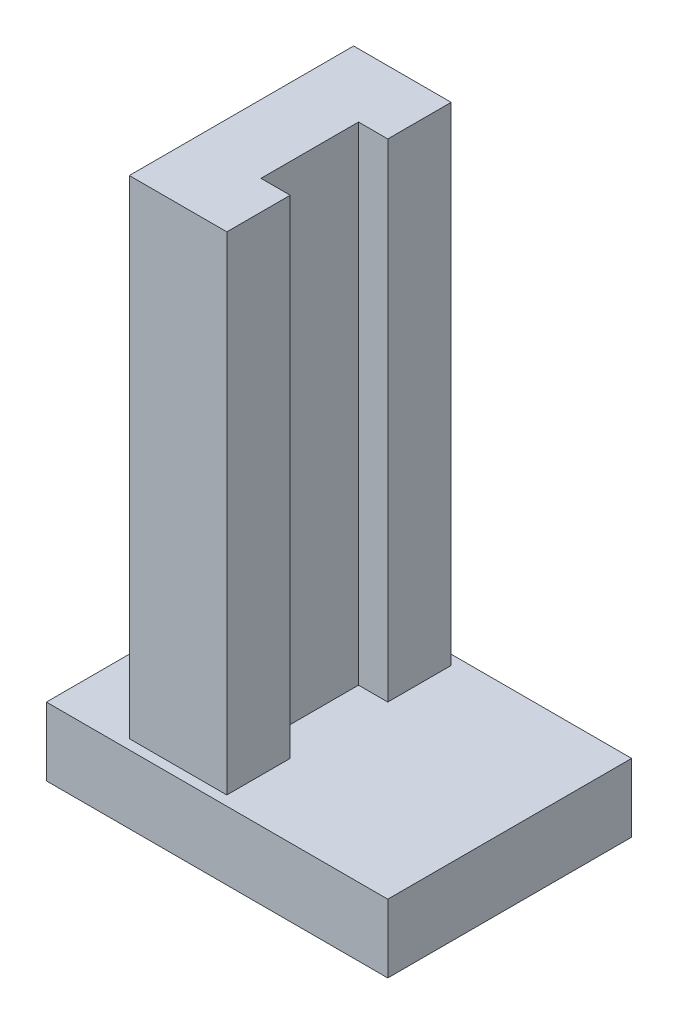
from build123d import *

# Parameters (mm, degrees)
CROQUIS1_W              = 175
CROQUIS1_H              = 125
SALIENTE_EXTRUIR1_DEPTH = 35
CROQUIS2_W              = 50
CROQUIS2_H              = 115
SALIENTE_EXTRUIR2_DEPTH = 250
CROQUIS3_W              = 50
CROQUIS3_H              = 250
CORTAR_EXTRUIR1_DEPTH   = 15


with BuildPart() as part:
    # Croquis1 → Saliente-Extruir1 (new body)
    with BuildSketch(Plane(origin=(0, 0, 0), x_dir=(1, 0, 0), z_dir=(0, 1, 0))):
        Rectangle(CROQUIS1_W, CROQUIS1_H)
    extrude(amount=SALIENTE_EXTRUIR1_DEPTH)

    # Croquis2 → Saliente-Extruir2 (add)
    with BuildSketch(Plane(origin=(0, 35, 0), x_dir=(1, 0, 0), z_dir=(0, 1, 0))):
        with Locations((-25, 0)):
            Rectangle(CROQUIS2_W, CROQUIS2_H)
    extrude(amount=SALIENTE_EXTRUIR2_DEPTH)

    # Croquis3 → Cortar-Extruir1 (cut)
    with BuildSketch(Plane(origin=(0, 0, 0), x_dir=(0, 0, -1), z_dir=(1, 0, 0))):
        with Locations((0, 160)):
            Rectangle(CROQUIS3_W, CROQUIS3_H)
    extrude(amount=-CORTAR_EXTRUIR1_DEPTH, mode=Mode.SUBTRACT)


solid = part.part
